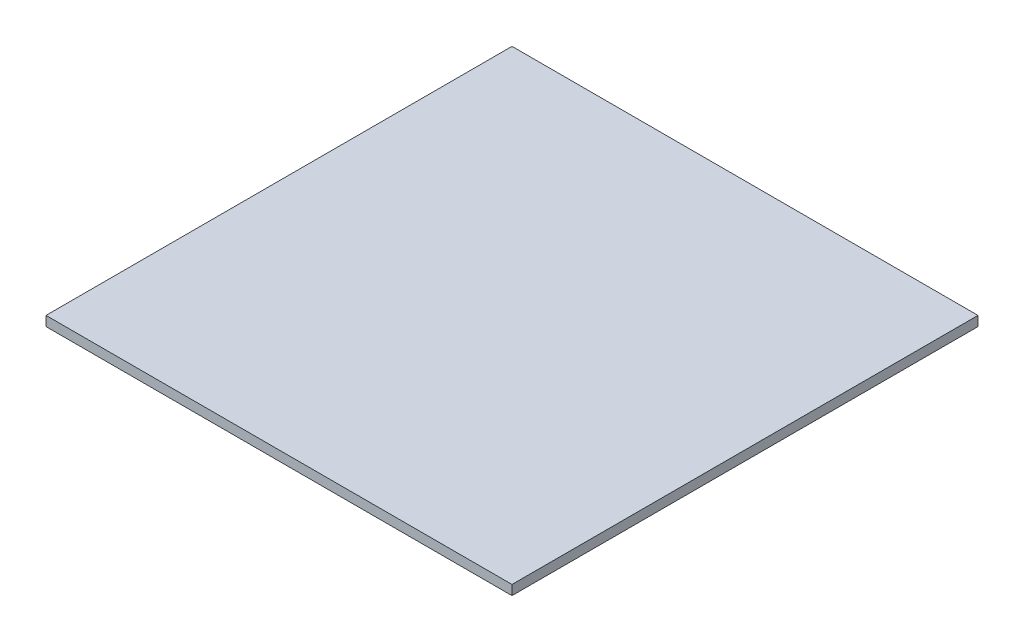
from build123d import *

# Parameters (mm, degrees)
SKETCH3_W           = 609.6
SKETCH3_H           = 609.6
BOSS_EXTRUDE1_DEPTH = 6.35


with BuildPart() as part:
    # Sketch3 → Boss-Extrude1 (new, symmetric)
    with BuildSketch(Plane(origin=(0, 0, 0), x_dir=(1, 0, 0), z_dir=(0, 1, 0))):
        Rectangle(SKETCH3_W, SKETCH3_H)
    extrude(amount=BOSS_EXTRUDE1_DEPTH, both=True)


solid = part.part
